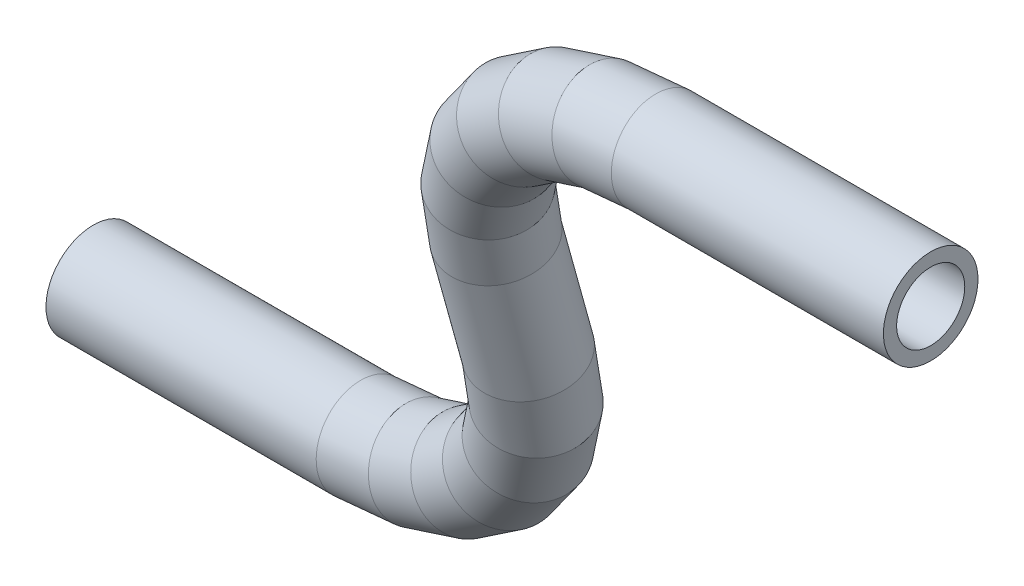
from build123d import *

# Parameters (mm, degrees)
PROFILE_R   = 3.175
PROFILE_R_2 = 2.286


with BuildPart() as part:
    # Tube: sweep along a curve in space
    with BuildLine() as tube_path:
        Line((-2080.987960479, -26.697560814, -19.396913326), (-2099.187960479, -26.697560814, -19.396913326))
        Line((-2099.187960479, -26.697560814, -19.396913326), (-2103.070246155, -27.190097062, -19.533456874))
        Line((-2103.070246155, -27.190097062, -19.533456874), (-2106.687960479, -28.634140273, -19.933782302))
        Line((-2106.687960479, -28.634140273, -19.933782302), (-2109.794562197, -30.931281289, -20.570608092))
        Line((-2109.794562197, -30.931281289, -20.570608092), (-2112.178341536, -33.924973747, -21.400535621))
        Line((-2112.178341536, -33.924973747, -21.400535621), (-2113.676847873, -37.411202452, -22.367006697))
        Line((-2113.676847873, -37.411202452, -22.367006697), (-2114.187960479, -41.15238668, -23.404157916))
        Line((-2114.187960479, -41.15238668, -23.404157916), (-2114.187960479, -48.986719227, -25.576033732))
        Line((-2114.187960479, -48.986719227, -25.576033732), (-2114.699073085, -52.727903455, -26.61318495))
        Line((-2114.699073085, -52.727903455, -26.61318495), (-2116.197579422, -56.21413216, -27.579656027))
        Line((-2116.197579422, -56.21413216, -27.579656027), (-2118.581358761, -59.207824618, -28.409583555))
        Line((-2118.581358761, -59.207824618, -28.409583555), (-2121.687960479, -61.504965634, -29.046409346))
        Line((-2121.687960479, -61.504965634, -29.046409346), (-2125.305674802, -62.949008845, -29.446734774))
        Line((-2125.305674802, -62.949008845, -29.446734774), (-2129.187960479, -63.441545093, -29.583278322))
        Line((-2129.187960479, -63.441545093, -29.583278322), (-2147.387960479, -63.441545093, -29.583278322))
    # Profile → Tube (sweep)
    with BuildSketch(Plane(origin=(-2080.987960479, 0, 0), x_dir=(0, 0, -1), z_dir=(1, 0, 0))):
        with Locations((19.396913326, -26.697560814)):
            Circle(PROFILE_R)
        with Locations((19.396913326, -26.697560814)):
            Circle(PROFILE_R_2, mode=Mode.SUBTRACT)
    sweep(path=tube_path.line, transition=Transition.RIGHT)


solid = part.part
